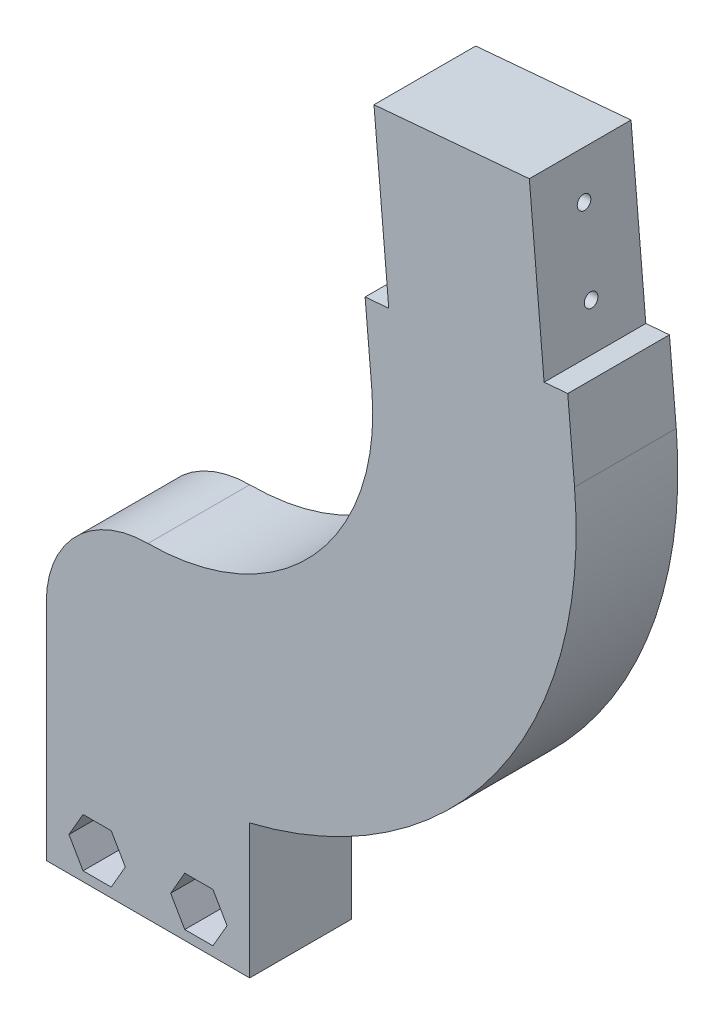
from build123d import *

# Parameters (mm, degrees)
SKETCH_395_R           = 7.6
EXTRUDE_923_DEPTH      = 15
CUT_EXTRUDE_1359_DEPTH = 10
SKETCH_4236_W          = 30
SKETCH_4236_H          = 12
SKETCH_4236_R          = 2.15
SKETCH_4236_R_2        = 4.1
EXTRUDE_5757_DEPTH     = 15
SKETCH_1_3_R           = 12.15
SKETCH_1_3_R_2         = 10.65
CUT_EXTRUDE_5889_DEPTH = 5
SKETCH_1_4_R           = 10.65
CUT_EXTRUDE_5977_DEPTH = 8.5
CUT_EXTRUDE_7570_DEPTH = 6
SKETCH_1_R             = 7.65
EXTRUDE_7865_DEPTH     = 6.5


with BuildPart() as part:
    # Sketch 395 → Extrude 923 (new body)
    with BuildSketch(Plane.XY):
        with BuildLine():
            Line((33.023854242, 2.889212872), (32.0215632, 14.3454519))
            Line((32.0215632, 14.3454519), (35.508244643, 14.650497))
            Line((35.508244643, 14.650497), (33.329351075, 39.555364452))
            Line((33.329351075, 39.555364452), (56.241829131, 41.559946535))
            Line((56.241829131, 41.559946535), (58.4207227, 16.655079083))
            Line((58.4207227, 16.655079083), (61.907404143, 16.960124183))
            Line((61.907404143, 16.960124183), (62.909695184, 5.503885155))
            ThreePointArc((62.909695184, 5.503885155), (46.55906382, -42.663521611), (0, -63.15))
            ThreePointArc((0, -63.15), (-15, -48.15), (0, -33.15))
            ThreePointArc((0, -33.15), (24.440743715, -22.395815382), (33.023854242, 2.889212872))
        make_face()
        with Locations((0, -48.15)):
            Circle(SKETCH_395_R, mode=Mode.SUBTRACT)
    extrude(amount=EXTRUDE_923_DEPTH)

    # Sketch 978 → Cut-Extrude 1359 (cut)
    with BuildSketch(Plane(origin=(62.909695184, 5.503885155, 0), x_dir=(0, 0, -1), z_dir=(0.9961946980917458, 0.08715574274765542, 0))):
        with BuildLine():
            ThreePointArc((-6.5, 30), (-6.792893219, 30.707106781), (-7.5, 31))
            Line((-7.5, 31), (-7.5, 29))
            ThreePointArc((-7.5, 29), (-6.792893219, 29.292893219), (-6.5, 30))
        make_face()
        with BuildLine():
            Line((-7.5, 29), (-7.5, 31))
            ThreePointArc((-7.5, 31), (-8.5, 30), (-7.5, 29))
        make_face()
        with BuildLine():
            ThreePointArc((-6.5, 18), (-6.792893219, 18.707106781), (-7.5, 19))
            Line((-7.5, 19), (-7.5, 17))
            ThreePointArc((-7.5, 17), (-6.792893219, 17.292893219), (-6.5, 18))
        make_face()
        with BuildLine():
            Line((-7.5, 17), (-7.5, 19))
            ThreePointArc((-7.5, 19), (-8.5, 18), (-7.5, 17))
        make_face()
    cut_extrude_1359 = extrude(amount=-CUT_EXTRUDE_1359_DEPTH, mode=Mode.SUBTRACT)

    # Mirror 1435: Cut-Extrude 1359 across plane
    add(cut_extrude_1359.mirror(Plane(origin=(47.966774713, 4.196549013, 0), x_dir=(0, 0, 1), z_dir=(0.9961946980917455, 0.0871557427476578, 0))), mode=Mode.SUBTRACT)

    # Sketch 4236 → Extrude 5757 (add)
    # profile 1 of 5: a face of its own
    with BuildSketch(Plane(origin=(0, 0, 0), x_dir=(-1, 0, 0), z_dir=(0, 0, -1))):
        with BuildLine():
            ThreePointArc((0, -63.15), (-7.554244854, -62.69653806), (-15, -61.342664598))
            Line((-15, -61.342664598), (-15, -69.15))
            Line((-15, -69.15), (15, -69.15))
            Line((15, -69.15), (15, -48.15))
            ThreePointArc((15, -48.15), (10.606601718, -58.756601718), (0, -63.15))
        make_face()
    # profile 2 of 5: a face of its own
    with BuildSketch(Plane(origin=(0, 0, 0), x_dir=(-1, 0, 0), z_dir=(0, 0, -1))):
        with Locations((0, -75.15)):
            Rectangle(SKETCH_4236_W, SKETCH_4236_H)
        Polygon((-9.578460969, -72.55), (-5.421539031, -72.55), (-3.343078062, -76.15), (-5.421539031, -79.75), (-9.578460969, -79.75), (-11.656921938, -76.15), align=None, mode=Mode.SUBTRACT)
        Polygon((5.421539031, -79.75), (3.343078062, -76.15), (5.421539031, -72.55), (9.578460969, -72.55), (11.656921938, -76.15), (9.578460969, -79.75), align=None, mode=Mode.SUBTRACT)
    # profile 3 of 5: a face of its own
    with BuildSketch(Plane(origin=(0, 0, 0), x_dir=(-1, 0, 0), z_dir=(0, 0, -1))):
        Polygon((-5.421539031, -79.75), (-3.343078062, -76.15), (-5.421539031, -72.55), (-9.578460969, -72.55), (-11.656921938, -76.15), (-9.578460969, -79.75), align=None)
        with Locations((-7.5, -76.15)):
            Circle(SKETCH_4236_R, mode=Mode.SUBTRACT)
    # profile 4 of 5: a face of its own
    with BuildSketch(Plane(origin=(0, 0, 0), x_dir=(-1, 0, 0), z_dir=(0, 0, -1))):
        Polygon((5.421539031, -72.55), (9.578460969, -72.55), (11.656921938, -76.15), (9.578460969, -79.75), (5.421539031, -79.75), (3.343078062, -76.15), align=None)
        with Locations((7.5, -76.15)):
            Circle(SKETCH_4236_R, mode=Mode.SUBTRACT)
    # profile 5 of 5: a face of its own
    with BuildSketch(Plane(origin=(0, 0, 0), x_dir=(-1, 0, 0), z_dir=(0, 0, -1))):
        with Locations((0, -48.15)):
            Circle(SKETCH_4236_R_2)
    extrude(amount=-EXTRUDE_5757_DEPTH)


with BuildPart() as extrude_5757_kept_piece:
    # of the separate pieces the step leaves, the one the design keeps (extrude_5757_pieces_kept)
    add(part.part.solids().sort_by_distance((0, -33.15, 0))[0])

    # Эскиз1_3 → Cut-Extrude 5889 (cut)
    with BuildSketch(Plane(origin=(0, 0, 0), x_dir=(-1, 0, 0), z_dir=(0, 0, -1))):
        with Locations((0, -48.15)):
            Circle(SKETCH_1_3_R)
        with Locations((0, -48.15)):
            Circle(SKETCH_1_3_R_2, mode=Mode.SUBTRACT)
    extrude(amount=-CUT_EXTRUDE_5889_DEPTH, mode=Mode.SUBTRACT)

    # Эскиз1<4> → Cut-Extrude 5977 (cut)
    with BuildSketch(Plane(origin=(0, 0, 0), x_dir=(-1, 0, 0), z_dir=(0, 0, -1))):
        with Locations((0, -48.15)):
            Circle(SKETCH_1_4_R)
    extrude(amount=-CUT_EXTRUDE_5977_DEPTH, mode=Mode.SUBTRACT)

    # Sketch 6737 → Cut-Extrude 7570 (cut)
    with BuildSketch(Plane.XY.offset(15)):
        Polygon((5.421539031, -79.75), (3.343078062, -76.15), (5.421539031, -72.55), (9.578460969, -72.55), (11.656921938, -76.15), (9.578460969, -79.75), align=None)
        Polygon((-3.343078062, -76.15), (-5.421539031, -72.55), (-9.578460969, -72.55), (-11.656921938, -76.15), (-9.578460969, -79.75), (-5.421539031, -79.75), align=None)
    extrude(amount=-CUT_EXTRUDE_7570_DEPTH, mode=Mode.SUBTRACT)

    # Эскиз1 → Extrude 7865 (add)
    with BuildSketch(Plane(origin=(0, 0, 8.5), x_dir=(-1, 0, 0), z_dir=(0, 0, -1))):
        with Locations((0, -48.15)):
            Circle(SKETCH_1_R)
    extrude(amount=-EXTRUDE_7865_DEPTH)


solid = extrude_5757_kept_piece.part
